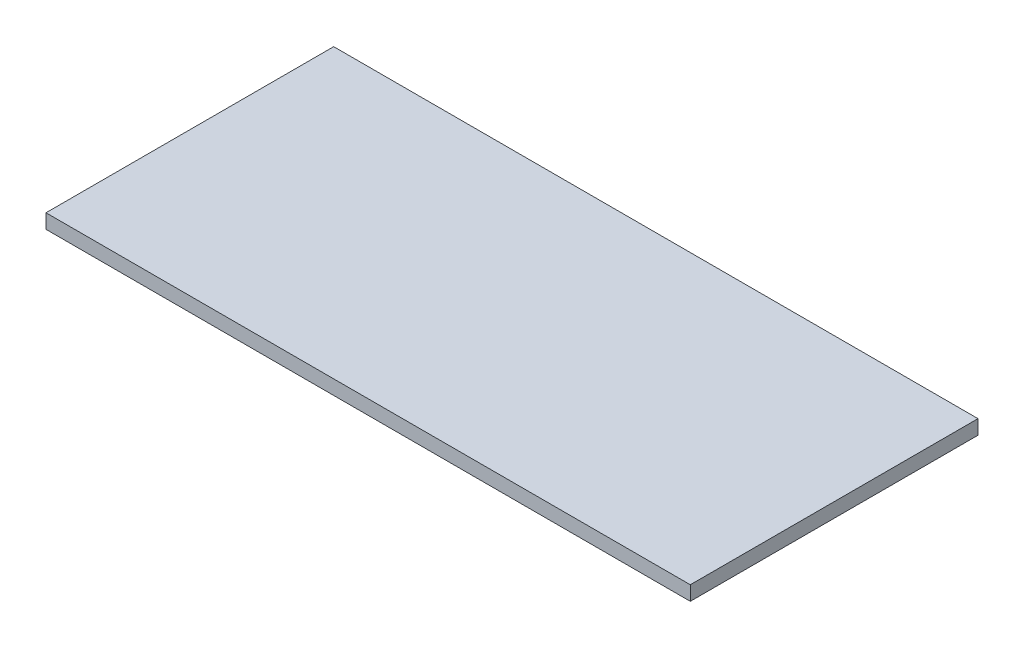
from build123d import *

# Parameters (mm, degrees)
SKETCH1_W           = 113.763569166
SKETCH1_H           = 2.54
EXTRUDE_THIN1_DEPTH = 50.8


with BuildPart() as part:
    # Sketch1 → Extrude-Thin1 (new body)
    with BuildSketch(Plane.XY):
        with Locations((3.768653144, -1.27)):
            Rectangle(SKETCH1_W, SKETCH1_H)
    extrude(amount=EXTRUDE_THIN1_DEPTH)


solid = part.part
